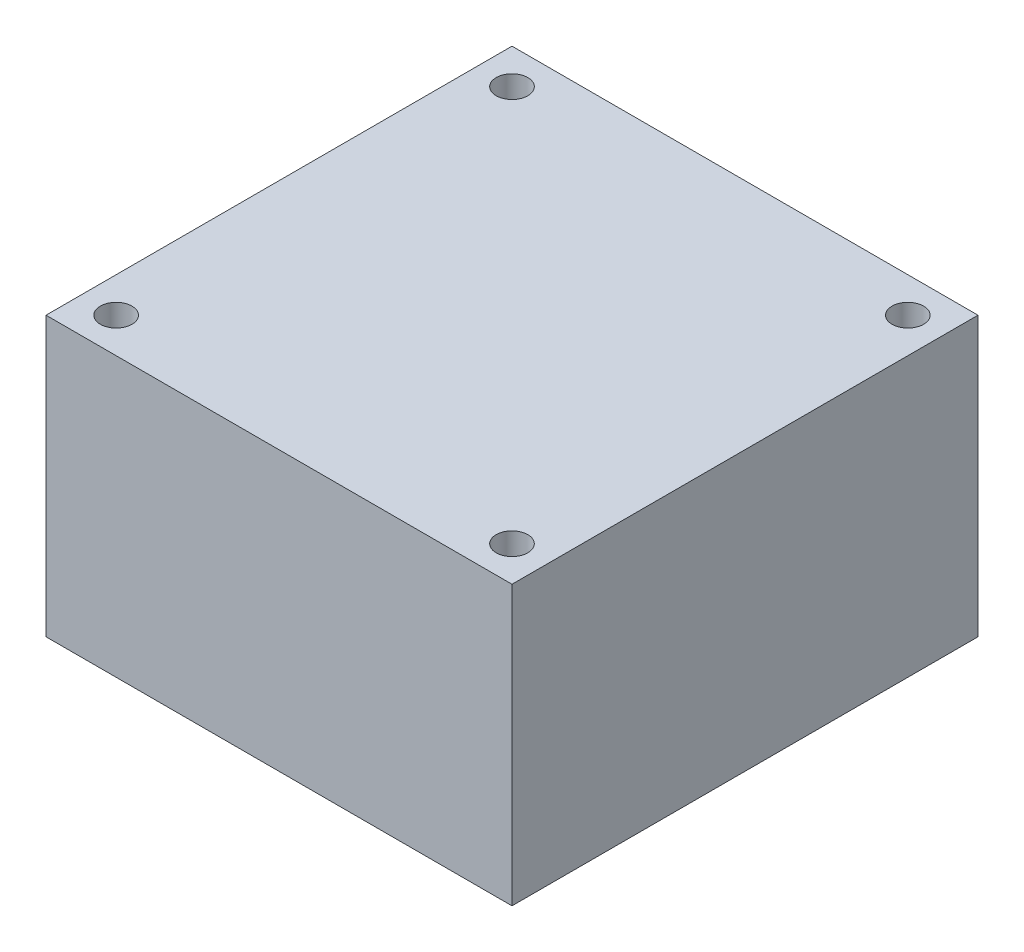
from build123d import *

# Parameters (mm, degrees)
SKETCH1_W           = 43.5
SKETCH1_H           = 43.5
BOSS_EXTRUDE1_DEPTH = 26
SKETCH2_R           = 1.475
CUT_EXTRUDE1_DEPTH  = 41.275612969


with BuildPart() as part:
    # Sketch1 → Boss-Extrude1 (new body)
    with BuildSketch(Plane(origin=(0, 0, 0), x_dir=(1, 0, 0), z_dir=(0, 1, 0))):
        Rectangle(SKETCH1_W, SKETCH1_H)
    extrude(amount=BOSS_EXTRUDE1_DEPTH)

    # Sketch2 → Cut-Extrude1 (cut, through all)
    with BuildSketch(Plane(origin=(0, 26, 0), x_dir=(1, 0, 0), z_dir=(0, 1, 0))):
        with Locations(Location((-18.475, 18.475, 0), (0, 0, 270))):
            Circle(SKETCH2_R)
        with Locations(Location((-18.475, -18.475, 0), (0, 0, 270))):
            Circle(SKETCH2_R)
        with Locations(Location((18.475, -18.475, 0), (0, 0, 270))):
            Circle(SKETCH2_R)
        with Locations(Location((18.475, 18.475, 0), (0, 0, 270))):
            Circle(SKETCH2_R)
    extrude(amount=-CUT_EXTRUDE1_DEPTH, mode=Mode.SUBTRACT)


solid = part.part
